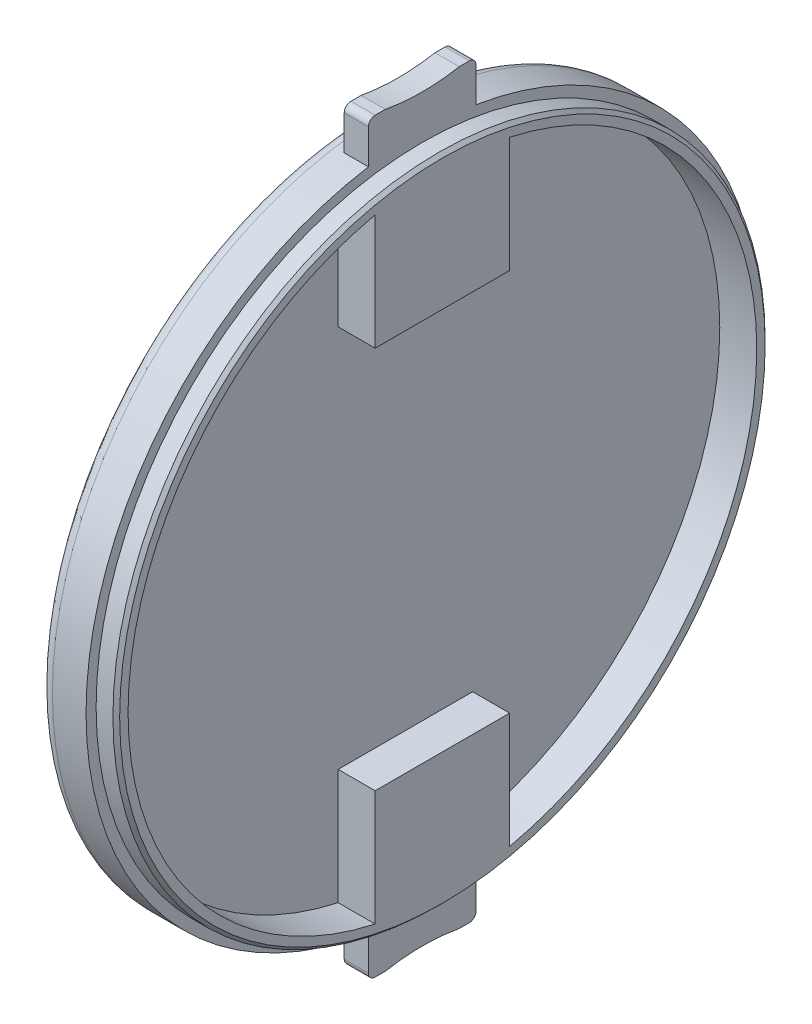
from build123d import *

# Parameters (mm, degrees)
CHANFREIN1_SIZE              = 0.5
BOSS_EXTRU_1_START           = 5.5
BOSS_EXTRU_1_DEPTH           = 5.5
BOSS_EXTRU_2_START           = -3.6
BOSS_EXTRU_2_DEPTH           = 3.6
R_P_TITION_CIRCULAIRE1_COUNT = 2


with BuildPart() as part:
    # Esquisse1 → Révolution1 (revolve)
    with BuildSketch(Plane.XY, mode=Mode.PRIVATE) as r_volution1_sk:
        with BuildLine():
            Line((0, 0), (0, 46.75))
            Line((0, 46.75), (5.5, 46.75))
            Line((5.5, 46.75), (5.5, 48.5))
            Line((5.5, 48.5), (2.5, 48.5))
            Line((2.5, 48.5), (2.5, 50))
            Line((2.5, 50), (-2.5, 50))
            ThreePointArc((-2.5, 50), (-3.914213562, 49.414213562), (-4.5, 48))
            Line((-4.5, 48), (-4.5, 0))
            Line((-4.5, 0), (0, 0))
        make_face()
    revolve(r_volution1_sk.sketch.rotate(Axis((0, 0, 0), (-1, 0, 0)), 90), axis=Axis((0, 0, 0), (-1, 0, 0)))

    # Chanfrein1
    chanfrein1_edges = [part.edges().sort_by_distance(p)[0] for p in [
        (5.5, 0, 48.5),
    ]]
    chamfer(chanfrein1_edges, length=CHANFREIN1_SIZE)

    # Esquisse2 → Boss.-Extru.1 (add)
    with BuildSketch(Plane(origin=(0, 0, 0), x_dir=(0, 0, -1), z_dir=(1, 0, 0)).offset(BOSS_EXTRU_1_START)):
        with BuildLine():
            Line((-10, 45.667959227), (-10, 28.5))
            Line((-10, 28.5), (10, 28.5))
            Line((10, 28.5), (10, 45.667959227))
            ThreePointArc((10, 45.667959227), (0, 46.75), (-10, 45.667959227))
        make_face()
        with BuildLine():
            Line((-10, -28.5), (10, -28.5))
            Line((10, -28.5), (10, -45.667959227))
            ThreePointArc((10, -45.667959227), (0, -46.75), (-10, -45.667959227))
            Line((-10, -45.667959227), (-10, -28.5))
        make_face()
    extrude(amount=-BOSS_EXTRU_1_DEPTH)

    # Esquisse3 → Boss.-Extru.2 (add)
    with BuildSketch(Plane(origin=(2.5, 0, 0), x_dir=(0, 0, -1), z_dir=(1, 0, 0)).offset(BOSS_EXTRU_2_START)):
        with BuildLine():
            Line((-8, 54.5), (-8, 49.355850717))
            ThreePointArc((-8, 49.355850717), (0, 50), (8, 49.355850717))
            Line((8, 49.355850717), (8, 54.5))
            ThreePointArc((8, 54.5), (7.707106781, 55.207106781), (7, 55.5))
            Line((7, 55.5), (5.5, 55.5))
            ThreePointArc((5.5, 55.5), (0, 55), (-5.5, 55.5))
            Line((-5.5, 55.5), (-7, 55.5))
            ThreePointArc((-7, 55.5), (-7.707106781, 55.207106781), (-8, 54.5))
        make_face()
    boss_extru_2 = extrude(amount=BOSS_EXTRU_2_DEPTH)

    # Répétition circulaire1: Boss.-Extru.2 ×2 about axis
    r_p_tition_circulaire1_axis = Axis((0, 0, 0), (1, 0, 0))
    for i in range(1, R_P_TITION_CIRCULAIRE1_COUNT):
        add(boss_extru_2.rotate(r_p_tition_circulaire1_axis, i * 360 / R_P_TITION_CIRCULAIRE1_COUNT))


solid = part.part
